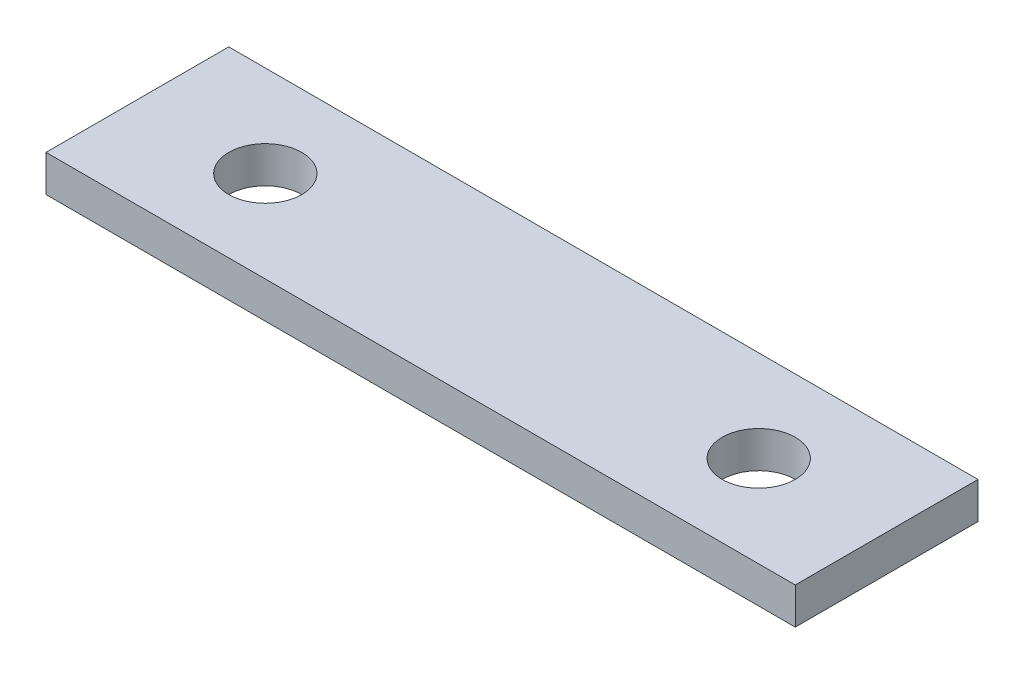
from build123d import *

# Parameters (mm, degrees)
SKETCH1_W           = 35
SKETCH1_H           = 10
BOSS_EXTRUDE1_DEPTH = 2
SKETCH4_R           = 2
CUT_EXTRUDE2_DEPTH  = 20
SKETCH5_W           = 10
SKETCH5_H           = 2
BOSS_EXTRUDE3_DEPTH = 3
SKETCH6_W           = 10
SKETCH6_H           = 2
BOSS_EXTRUDE4_DEPTH = 3


with BuildPart() as part:
    # Sketch1 → Boss-Extrude1 (new body)
    with BuildSketch(Plane(origin=(0, 0, 0), x_dir=(1, 0, 0), z_dir=(0, 1, 0))):
        with Locations((17.5, 5)):
            Rectangle(SKETCH1_W, SKETCH1_H)
    extrude(amount=BOSS_EXTRUDE1_DEPTH)

    # Sketch4 → Cut-Extrude2 (cut)
    with BuildSketch(Plane.XZ):
        with Locations(Location((4, -5, 0), (0, 0, 270))):
            Circle(SKETCH4_R)
        with Locations(Location((31, -5, 0), (0, 0, 270))):
            Circle(SKETCH4_R)
    extrude(amount=-CUT_EXTRUDE2_DEPTH, mode=Mode.SUBTRACT)

    # Sketch5 → Boss-Extrude3 (add)
    with BuildSketch(Plane.ZY):
        with Locations((-5, 1)):
            Rectangle(SKETCH5_W, SKETCH5_H)
    extrude(amount=BOSS_EXTRUDE3_DEPTH)

    # Sketch6 → Boss-Extrude4 (add)
    with BuildSketch(Plane(origin=(35, 0, 0), x_dir=(0, 0, -1), z_dir=(1, 0, 0))):
        with Locations((5, 1)):
            Rectangle(SKETCH6_W, SKETCH6_H)
    extrude(amount=BOSS_EXTRUDE4_DEPTH)


solid = part.part
